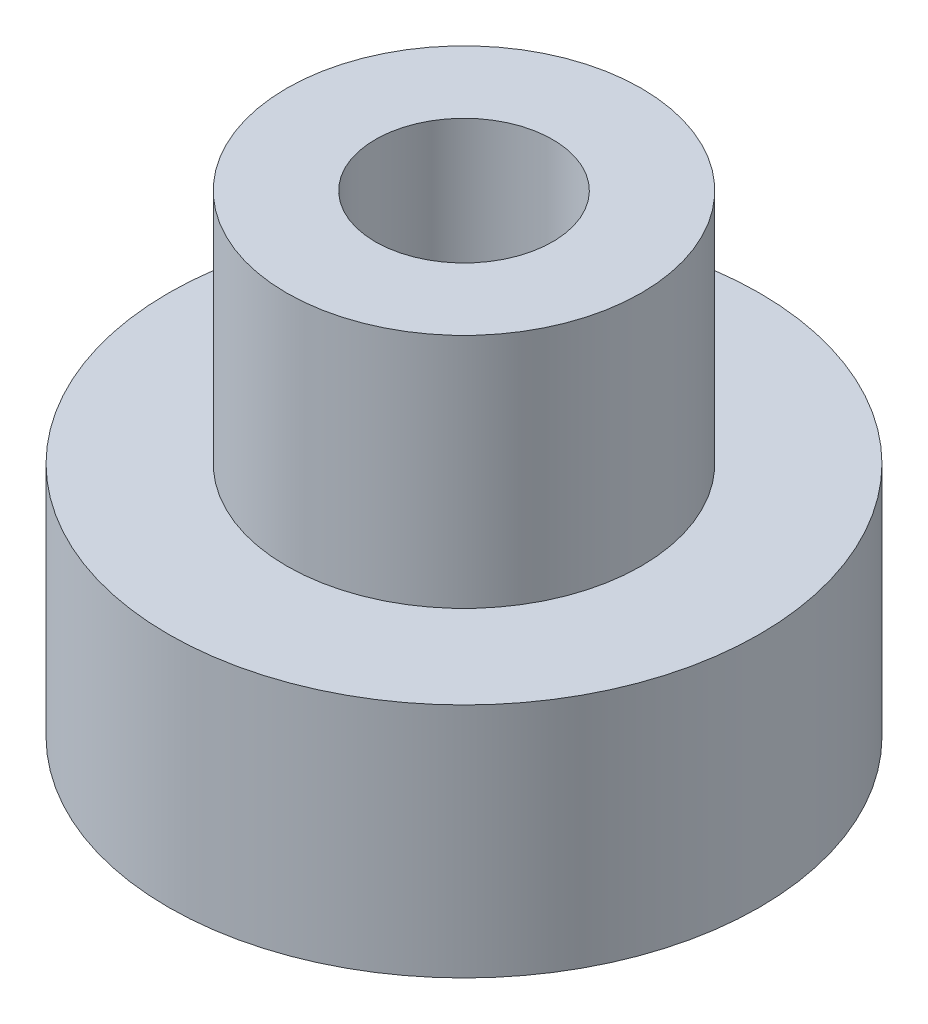
from build123d import *

# Parameters (mm, degrees)
SKETCH_1_R          = 3
EXTRUDE_1_DEPTH     = 8
SKETCH_2_R          = 1.5
CUT_EXTRUDE_1_DEPTH = 8
SKETCH_3_R          = 5
SKETCH_3_R_2        = 1.511526568
EXTRUDE_2_DEPTH     = 4


with BuildPart() as part:
    # 草图1 → 凸台-拉伸1 (new body)
    with BuildSketch(Plane(origin=(0, 0, 0), x_dir=(1, 0, 0), z_dir=(0, 1, 0))):
        with Locations(Location((0, 0, 0), (0, 0, 270))):
            Circle(SKETCH_1_R)
    extrude(amount=EXTRUDE_1_DEPTH)

    # 草图2 → 切除-拉伸1 (cut)
    with BuildSketch(Plane(origin=(0, 8, 0), x_dir=(1, 0, 0), z_dir=(0, 1, 0))):
        with Locations(Location((0, 0, 0), (0, 0, 270))):
            Circle(SKETCH_2_R)
    extrude(amount=-CUT_EXTRUDE_1_DEPTH, mode=Mode.SUBTRACT)

    # 草图3 → 凸台-拉伸2 (add)
    with BuildSketch(Plane.XZ):
        with Locations(Location((0, 0, 0), (0, 0, 270))):
            Circle(SKETCH_3_R)
        Circle(SKETCH_3_R_2, mode=Mode.SUBTRACT)
    extrude(amount=-EXTRUDE_2_DEPTH)


solid = part.part
